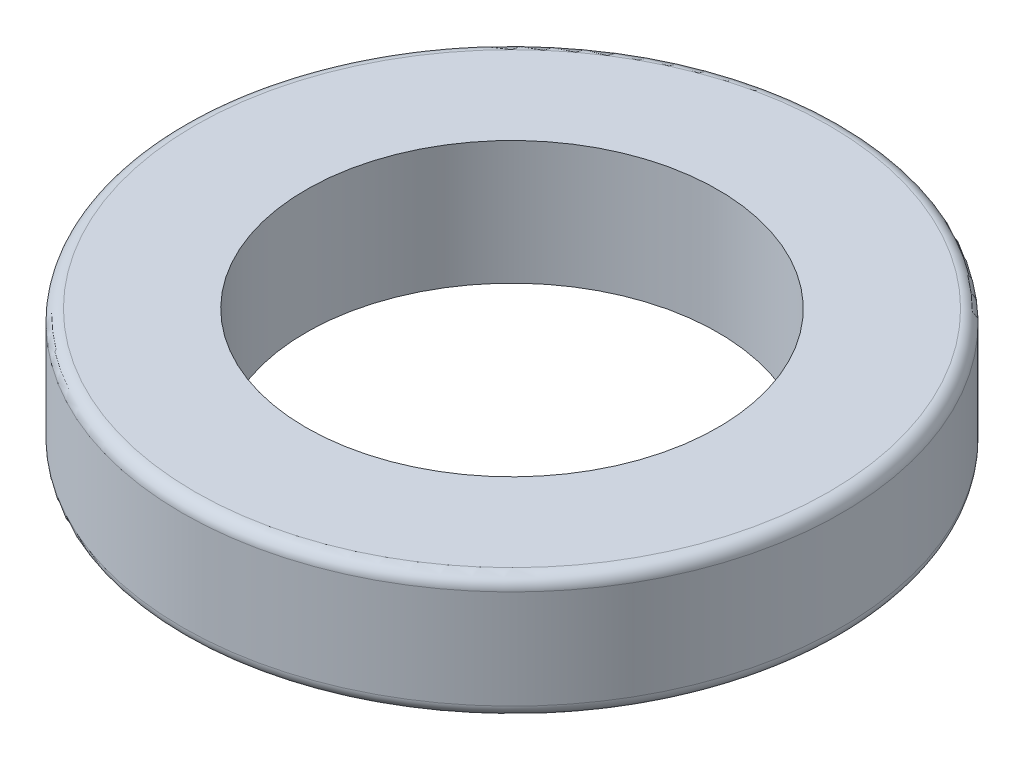
from build123d import *

# Parameters (mm, degrees)
SKETCH_1_R      = 8
SKETCH_1_R_2    = 5
EXTRUDE_1_DEPTH = 3
FILLET_1_R      = 0.3


with BuildPart() as part:
    # 草图1 → 凸台-拉伸1 (new body)
    with BuildSketch(Plane(origin=(0, 0, 0), x_dir=(1, 0, 0), z_dir=(0, 1, 0))):
        with Locations(Location((0, 0, 0), (0, 0, 270))):
            Circle(SKETCH_1_R)
        with Locations(Location((0, 0, 0), (0, 0, 270))):
            Circle(SKETCH_1_R_2, mode=Mode.SUBTRACT)
    extrude(amount=EXTRUDE_1_DEPTH)

    # 圆角1
    fillet_1_edges = [part.edges().sort_by_distance(p)[0] for p in [
        (0, 0, -8),
        (0, 3, -8),
    ]]
    fillet(fillet_1_edges, radius=FILLET_1_R)


solid = part.part
